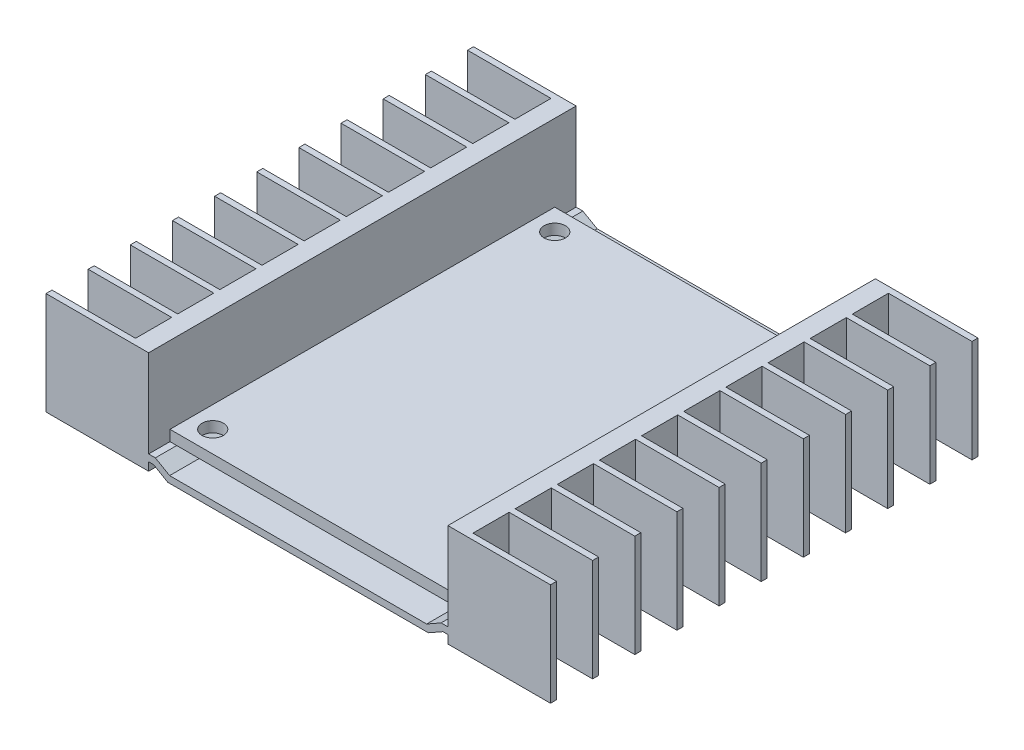
from build123d import *

# Parameters (mm, degrees)
SKETCH1_W                = 44.45
SKETCH1_H                = 57.15
SKETCH1_R                = 1.5875
BOSS_EXTRUDE1_DEPTH      = 1.5875
BOSS_EXTRUDE2_DEPTH      = 11.43
BOSS_EXTRUDE2_DEPTH_BACK = 3.81
BOSS_EXTRUDE3_REACH      = 120.467


with BuildPart() as part:
    # Sketch1 → Boss-Extrude1 (new body)
    with BuildSketch(Plane(origin=(0, 0, 0), x_dir=(1, 0, 0), z_dir=(0, 1, 0))):
        with Locations((-61.695053498, -38.539128831)):
            Rectangle(SKETCH1_W, SKETCH1_H)
        with Locations(Location((-80.745053498, -63.939128831, 0), (0, 0, 270))):
            Circle(SKETCH1_R, mode=Mode.SUBTRACT)
        with Locations(Location((-42.645053498, -63.939128831, 0), (0, 0, 270))):
            Circle(SKETCH1_R, mode=Mode.SUBTRACT)
        with Locations(Location((-42.645053498, -13.139128831, 0), (0, 0, 270))):
            Circle(SKETCH1_R, mode=Mode.SUBTRACT)
        with Locations(Location((-80.745053498, -13.139128831, 0), (0, 0, 270))):
            Circle(SKETCH1_R, mode=Mode.SUBTRACT)
    extrude(amount=BOSS_EXTRUDE1_DEPTH)

    # Sketch2 → Boss-Extrude2 (add, two sides: drawn at the far end of the back side and taken through both)
    with BuildSketch(Plane(origin=(0, 1.5875, 0), x_dir=(1, 0, 0), z_dir=(0, 1, 0)).offset(-BOSS_EXTRUDE2_DEPTH_BACK)):
        Polygon((-99.160053498, -6.789128831), (-83.920053498, -6.789128831), (-83.920053498, -70.289128831), (-99.160053498, -70.289128831), (-99.160053498, -69.394762634), (-86.755200336, -69.394762634), (-86.755200336, -64.028565451), (-99.160053498, -64.028565451), (-99.160053498, -63.134199254), (-86.755200336, -63.134199254), (-86.755200336, -57.768002071), (-99.160053498, -57.768002071), (-99.160053498, -56.873635873), (-86.755200336, -56.873635873), (-86.755200336, -51.50743869), (-99.160053498, -51.50743869), (-99.160053498, -50.613072493), (-86.755200336, -50.613072493), (-86.755200336, -45.24687531), (-99.160053498, -45.24687531), (-99.160053498, -44.352509113), (-86.755200336, -44.352509113), (-86.755200336, -38.98631193), (-99.160053498, -38.98631193), (-99.160053498, -38.091945732), (-86.755200336, -38.091945732), (-86.755200336, -32.725748549), (-99.160053498, -32.725748549), (-99.160053498, -31.831382352), (-86.755200336, -31.831382352), (-86.755200336, -26.465185169), (-99.160053498, -26.465185169), (-99.160053498, -25.570818972), (-86.755200336, -25.570818972), (-86.755200336, -20.204621789), (-99.160053498, -20.204621789), (-99.160053498, -19.310255592), (-86.755200336, -19.310255592), (-86.755200336, -13.944058409), (-99.160053498, -13.944058409), (-99.160053498, -13.049692211), (-86.755200336, -13.049692211), (-86.755200336, -7.683495028), (-99.160053498, -7.683495028), align=None)
        Polygon((-24.230053498, -7.683495028), (-24.230053498, -6.789128831), (-39.470053498, -6.789128831), (-39.470053498, -70.289128831), (-24.230053498, -70.289128831), (-24.230053498, -69.394762634), (-36.63490666, -69.394762634), (-36.63490666, -64.028565451), (-24.230053498, -64.028565451), (-24.230053498, -63.134199254), (-36.63490666, -63.134199254), (-36.63490666, -57.768002071), (-24.230053498, -57.768002071), (-24.230053498, -56.873635873), (-36.63490666, -56.873635873), (-36.63490666, -51.50743869), (-24.230053498, -51.50743869), (-24.230053498, -50.613072493), (-36.63490666, -50.613072493), (-36.63490666, -45.24687531), (-24.230053498, -45.24687531), (-24.230053498, -44.352509113), (-36.63490666, -44.352509113), (-36.63490666, -38.98631193), (-24.230053498, -38.98631193), (-24.230053498, -38.091945732), (-36.63490666, -38.091945732), (-36.63490666, -32.725748549), (-24.230053498, -32.725748549), (-24.230053498, -31.831382352), (-36.63490666, -31.831382352), (-36.63490666, -26.465185169), (-24.230053498, -26.465185169), (-24.230053498, -25.570818972), (-36.63490666, -25.570818972), (-36.63490666, -20.204621789), (-24.230053498, -20.204621789), (-24.230053498, -19.310255592), (-36.63490666, -19.310255592), (-36.63490666, -13.944058409), (-24.230053498, -13.944058409), (-24.230053498, -13.049692211), (-36.63490666, -13.049692211), (-36.63490666, -7.683495028), align=None)
    extrude(amount=BOSS_EXTRUDE2_DEPTH + BOSS_EXTRUDE2_DEPTH_BACK)

    # Boss-Extrude3: up to this face of the body (flat: up to its plane)
    boss_extrude3_end = Plane(part.part.faces().sort_by_distance((-91.540053498, 5.3975, 6.789128831))[0])
    # Sketch4 → Boss-Extrude3 (add, up to the picked face)
    with BuildSketch(Plane.XY.offset(70.289128831), mode=Mode.PRIVATE) as boss_extrude3_sk1:
        Polygon((-83.920053498, 0), (-82.920053498, 0), (-80.802621386, -1.2225), (-42.623870056, -1.2225), (-40.470053498, 0), (-39.470053498, 0), (-39.470053498, -1), (-40.206037044, -1), (-42.359853602, -2.2225), (-81.070570578, -2.2225), (-83.188002691, -1), (-83.920053498, -1), align=None)
    boss_extrude3_tool1 = split(extrude(boss_extrude3_sk1.sketch, amount=-BOSS_EXTRUDE3_REACH, mode=Mode.PRIVATE), bisect_by=boss_extrude3_end, keep=Keep.BOTH, mode=Mode.PRIVATE)
    add(boss_extrude3_tool1.solids().sort_by(Axis((-61.697362, -1.608795, 70.289129), (0, 0, -1)))[0])


solid = part.part
